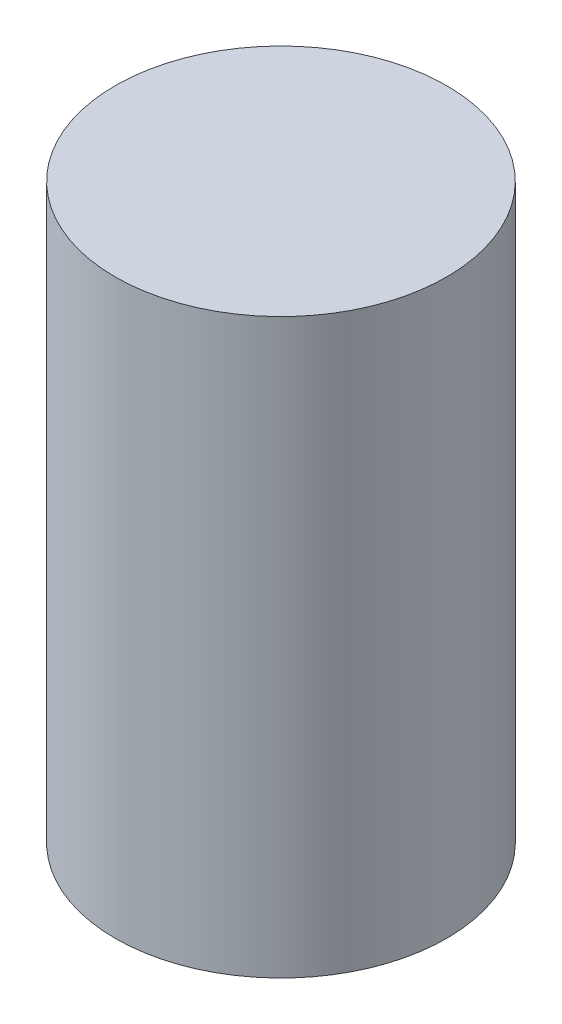
from build123d import *

# Parameters (mm, degrees)
SKETCH1_R           = 20.25
BOSS_EXTRUDE1_DEPTH = 70


with BuildPart() as part:
    # Sketch1 → Boss-Extrude1 (new body)
    with BuildSketch(Plane(origin=(0, 0, 0), x_dir=(1, 0, 0), z_dir=(0, 1, 0))):
        with Locations(Location((0, 0, 0), (0, 0, 270))):
            Circle(SKETCH1_R)
    extrude(amount=BOSS_EXTRUDE1_DEPTH)


solid = part.part
